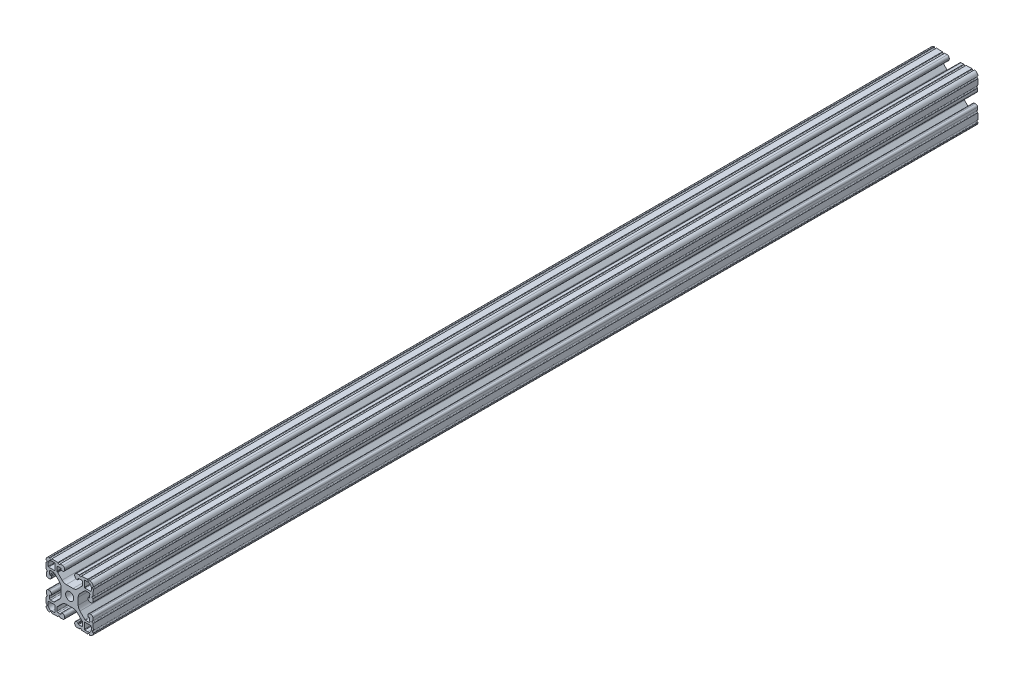
from build123d import *

# Parameters (mm, degrees)
BOSS_EXTRUDE1_DEPTH     = 355.6
CUT_EXTRUDE2_DEPTH      = 357.619075485
CUT_EXTRUDE2_DEPTH_BACK = 357.619075485
CUT_EXTRUDE1_DEPTH      = 357.617795912
CUT_EXTRUDE1_DEPTH_BACK = 357.617795912


with BuildPart() as part:
    # Sketch4 → Boss-Extrude1 (new, symmetric)
    with BuildSketch(Plane.XY):
        with BuildLine():
            Line((15.764194098, -19.048065876), (5.596097049, -18.692988103))
            ThreePointArc((5.596097049, -18.692988103), (4.509548067, -18.209225328), (4.064, -17.106455165))
            Line((4.064, -17.106455165), (4.064, -16.343990692))
            ThreePointArc((4.064, -16.343990692), (4.548729837, -15.202038759), (5.706902951, -14.757457754))
            Line((5.706902951, -14.757457754), (6.490296708, -14.784814467))
            ThreePointArc((6.490296708, -14.784814467), (6.751068464, -14.900917533), (6.858, -15.165582372))
            Line((6.858, -15.165582372), (6.858, -15.689138401))
            ThreePointArc((6.858, -15.689138401), (6.964931536, -15.95380324), (7.225703292, -16.069906306))
            Line((7.225703292, -16.069906306), (9.465548524, -16.148123425))
            ThreePointArc((9.465548524, -16.148123425), (10.044635082, -15.925832923), (10.287, -15.354856956))
            Line((10.287, -15.354856956), (10.287, -12.771043484))
            ThreePointArc((10.287, -12.771043484), (10.226579379, -12.46728851), (10.054516008, -12.209777477))
            Line((10.054516008, -12.209777477), (6.093922742, -8.249184211))
            ThreePointArc((6.093922742, -8.249184211), (4.552976719, -7.219556996), (2.735306952, -6.858))
            Line((2.735306952, -6.858), (0, -6.858))
            Line((0, -6.858), (0, -3.2639))
            ThreePointArc((0, -3.2639), (2.307925823, -2.307925823), (3.2639, 0))
            Line((3.2639, 0), (6.858, 0))
            Line((6.858, 0), (6.858, -2.735306952))
            ThreePointArc((6.858, -2.735306952), (7.219556996, -4.552976719), (8.249184211, -6.093922742))
            Line((8.249184211, -6.093922742), (12.209777477, -10.054516008))
            ThreePointArc((12.209777477, -10.054516008), (12.46728851, -10.226579379), (12.771043484, -10.287))
            Line((12.771043484, -10.287), (15.354856956, -10.287))
            ThreePointArc((15.354856956, -10.287), (15.925832923, -10.044635082), (16.148123425, -9.465548524))
            Line((16.148123425, -9.465548524), (16.069906306, -7.225703292))
            ThreePointArc((16.069906306, -7.225703292), (15.95380324, -6.964931536), (15.689138401, -6.858))
            Line((15.689138401, -6.858), (15.165582372, -6.858))
            ThreePointArc((15.165582372, -6.858), (14.900917533, -6.751068464), (14.784814467, -6.490296708))
            Line((14.784814467, -6.490296708), (14.757457754, -5.706902951))
            ThreePointArc((14.757457754, -5.706902951), (15.202038759, -4.548729837), (16.343990692, -4.064))
            Line((16.343990692, -4.064), (17.106455165, -4.064))
            ThreePointArc((17.106455165, -4.064), (18.209225328, -4.509548067), (18.692988103, -5.596097049))
            Line((18.692988103, -5.596097049), (19.048065876, -15.764194098))
            ThreePointArc((19.048065876, -15.764194098), (18.12006403, -18.12006403), (15.764194098, -19.048065876))
        make_face()
        with BuildLine():
            Line((11.8872, -12.2682), (11.8872, -16.943575443))
            ThreePointArc((11.8872, -16.943575443), (11.994131536, -17.208240282), (12.254903292, -17.324343348))
            Line((12.254903292, -17.324343348), (14.445350862, -17.400835462))
            ThreePointArc((14.445350862, -17.400835462), (16.565633801, -16.565633801), (17.400835462, -14.445350862))
            Line((17.400835462, -14.445350862), (17.324343348, -12.254903292))
            ThreePointArc((17.324343348, -12.254903292), (17.208240282, -11.994131536), (16.943575443, -11.8872))
            Line((16.943575443, -11.8872), (12.2682, -11.8872))
            ThreePointArc((12.2682, -11.8872), (11.998792316, -11.998792316), (11.8872, -12.2682))
        make_face(mode=Mode.SUBTRACT)
    extrude(amount=BOSS_EXTRUDE1_DEPTH, both=True)

    # Sketch8 → Cut-Extrude2 (cut, two sides: drawn at the far end of the back side and taken through both)
    with BuildSketch(Plane.XY.offset(-CUT_EXTRUDE2_DEPTH_BACK)):
        with BuildLine():
            Line((7.649186899, -18.76468358), (9.495813101, -18.829169188))
            Line((9.495813101, -18.829169188), (9.278946369, -18.421302187))
            ThreePointArc((9.278946369, -18.421302187), (8.600423087, -17.997313783), (7.893976718, -18.372937981))
            Line((7.893976718, -18.372937981), (7.649186899, -18.76468358))
        make_face()
        with BuildLine():
            Line((14.316686899, -18.997517811), (16.163313101, -19.062003418))
            Line((16.163313101, -19.062003418), (15.946446369, -18.654136417))
            ThreePointArc((15.946446369, -18.654136417), (15.267923087, -18.230148014), (14.561476718, -18.605772211))
            Line((14.561476718, -18.605772211), (14.316686899, -18.997517811))
        make_face()
        with BuildLine():
            Line((18.605772211, -14.561476718), (18.997517811, -14.316686899))
            Line((18.997517811, -14.316686899), (19.062003418, -16.163313101))
            Line((19.062003418, -16.163313101), (18.654136417, -15.946446369))
            ThreePointArc((18.654136417, -15.946446369), (18.230148014, -15.267923087), (18.605772211, -14.561476718))
        make_face()
        with BuildLine():
            Line((18.372937981, -7.893976718), (18.76468358, -7.649186899))
            Line((18.76468358, -7.649186899), (18.829169188, -9.495813101))
            Line((18.829169188, -9.495813101), (18.421302187, -9.278946369))
            ThreePointArc((18.421302187, -9.278946369), (17.997313783, -8.600423087), (18.372937981, -7.893976718))
        make_face()
    extrude(amount=CUT_EXTRUDE2_DEPTH + CUT_EXTRUDE2_DEPTH_BACK, mode=Mode.SUBTRACT)

    # Mirror1: part across plane


with BuildPart() as part_1:
    add(part.part)
    add(part.part.mirror(Plane(origin=(0, 0, 0), x_dir=(0, 0, 1), z_dir=(1, 0, 0))))

    # Mirror2: part across plane


with BuildPart() as part_2:
    add(part_1.part)
    add(part_1.part.mirror(Plane.ZX))

    # Sketch5 → Cut-Extrude1 (cut, two sides: drawn at the far end of the back side and taken through both)
    with BuildSketch(Plane.XY.offset(-CUT_EXTRUDE1_DEPTH_BACK)):
        with BuildLine():
            Line((-10.133783723, 12.50797511), (-10.133783723, 11.99997511))
            ThreePointArc((-10.133783723, 11.99997511), (-10.084187138, 11.880238362), (-9.964450389, 11.830641777))
            Line((-9.964450389, 11.830641777), (-9.650582015, 11.830641777))
            Line((-9.650582015, 11.830641777), (-9.650582015, 12.50797511))
            Line((-9.650582015, 12.50797511), (-10.133783723, 12.50797511))
        make_face()
    extrude(amount=CUT_EXTRUDE1_DEPTH + CUT_EXTRUDE1_DEPTH_BACK, mode=Mode.SUBTRACT)


solid = part_2.part
